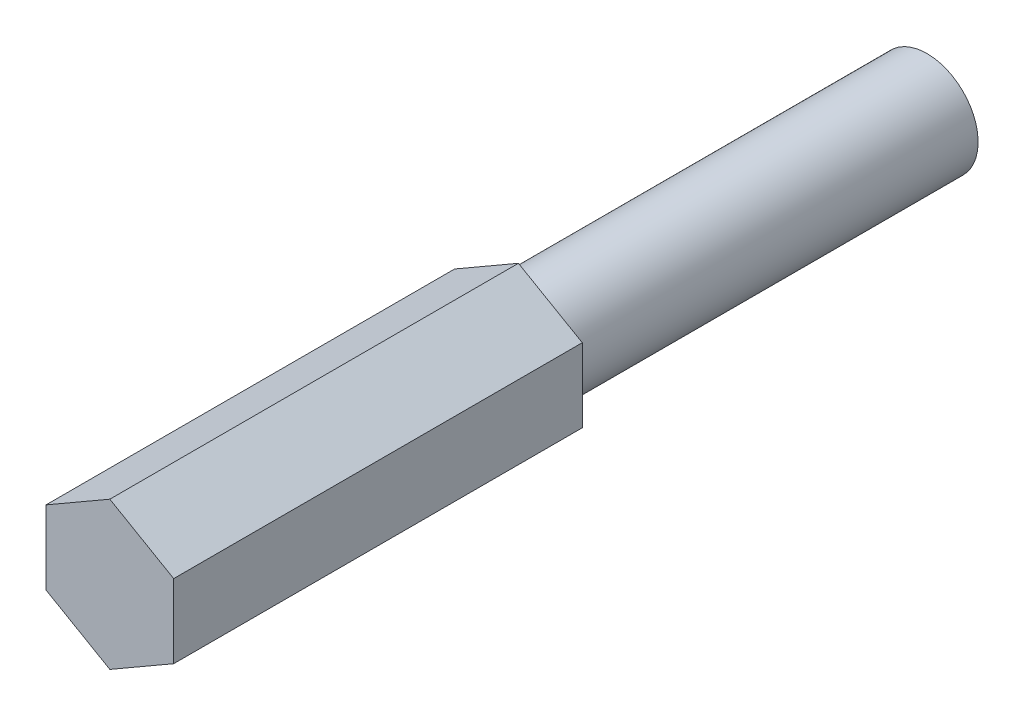
from build123d import *

# Parameters (mm, degrees)
HEX_2_DEPTH         = 25.4
SKETCH3_R           = 3.175
BOSS_EXTRUDE2_DEPTH = 25.4


with BuildPart() as part:
    # Sketch2 → Hex 2 (new body)
    with BuildSketch(Plane(origin=(0, 0, 0), x_dir=(0, 1, 0), z_dir=(0, 0, 1))):
        Polygon((4.582717762, 0), (2.291358881, 3.96875), (-2.291358881, 3.96875), (-4.582717762, 0), (-2.291358881, -3.96875), (2.291358881, -3.96875), align=None)
    extrude(amount=HEX_2_DEPTH)

    # Sketch3 → Boss-Extrude2 (add)
    with BuildSketch(Plane(origin=(0, 0, 0), x_dir=(1, 0, 0), z_dir=(0, 0, -1))):
        with Locations(Location((0, 0, 0), (0, 0, 180))):
            Circle(SKETCH3_R)
    extrude(amount=BOSS_EXTRUDE2_DEPTH)


solid = part.part
